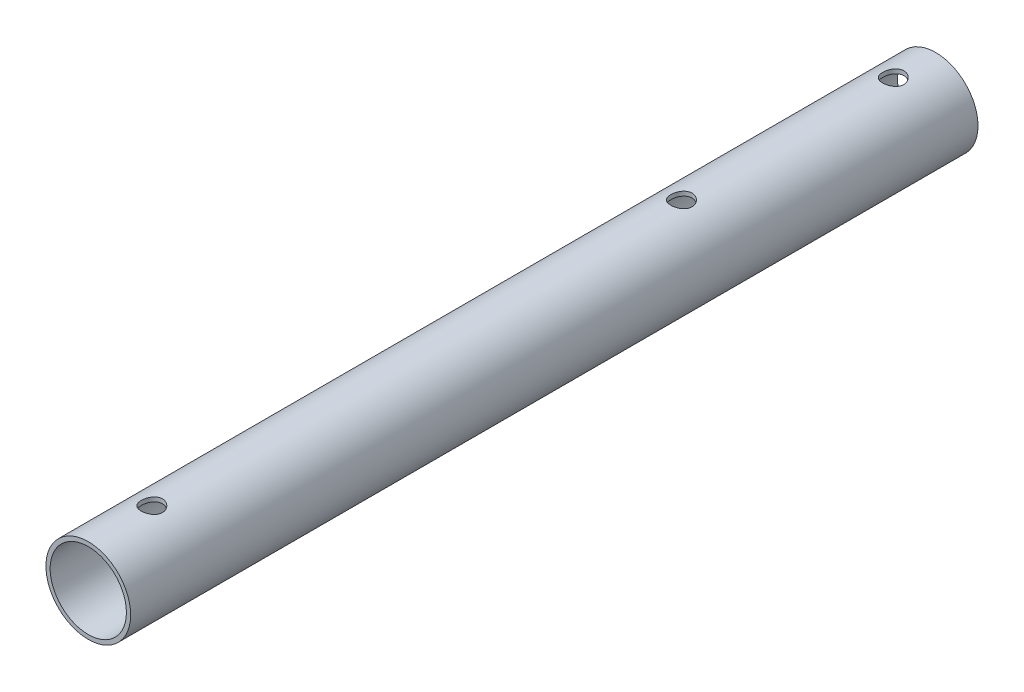
from build123d import *

# Parameters (mm, degrees)
IZIM1_R                     = 10
IZIM1_R_2                   = 9
Y_KSEKLIK_EKSTR_ZYON1_DEPTH = 200
KES_EKSTR_ZYON1_DEPTH       = 200
KES_EKSTR_ZYON1_DEPTH_BACK  = 200
IZIM2_R                     = 2.5
KES_EKSTR_ZYON2_DEPTH       = 200
KES_EKSTR_ZYON2_DEPTH_BACK  = 200
IZIM3_R                     = 2.5


with BuildPart() as part:
    # Çizim1 → Yükseklik-Ekstrüzyon1 (new body)
    with BuildSketch(Plane.XY):
        Circle(IZIM1_R)
        Circle(IZIM1_R_2, mode=Mode.SUBTRACT)
    extrude(amount=Y_KSEKLIK_EKSTR_ZYON1_DEPTH)

    # Çizim2 → Kes-Ekstrüzyon1 (cut, two sides: drawn at the far end of the back side and taken through both)
    with BuildSketch(Plane(origin=(0, 0, 0), x_dir=(1, 0, 0), z_dir=(0, 1, 0)).offset(-KES_EKSTR_ZYON1_DEPTH_BACK)):
        with Locations((0, -10)):
            Circle(IZIM2_R)
        with Locations((0, -60)):
            Circle(IZIM2_R)
    extrude(amount=KES_EKSTR_ZYON1_DEPTH + KES_EKSTR_ZYON1_DEPTH_BACK, mode=Mode.SUBTRACT)

    # Çizim3 → Kes-Ekstrüzyon2 (cut, two sides: drawn at the far end of the back side and taken through both)
    with BuildSketch(Plane(origin=(0, 0, 0), x_dir=(1, 0, 0), z_dir=(0, 1, 0)).offset(-KES_EKSTR_ZYON2_DEPTH_BACK)):
        with Locations((0, -185)):
            Circle(IZIM3_R)
    extrude(amount=KES_EKSTR_ZYON2_DEPTH + KES_EKSTR_ZYON2_DEPTH_BACK, mode=Mode.SUBTRACT)


solid = part.part
